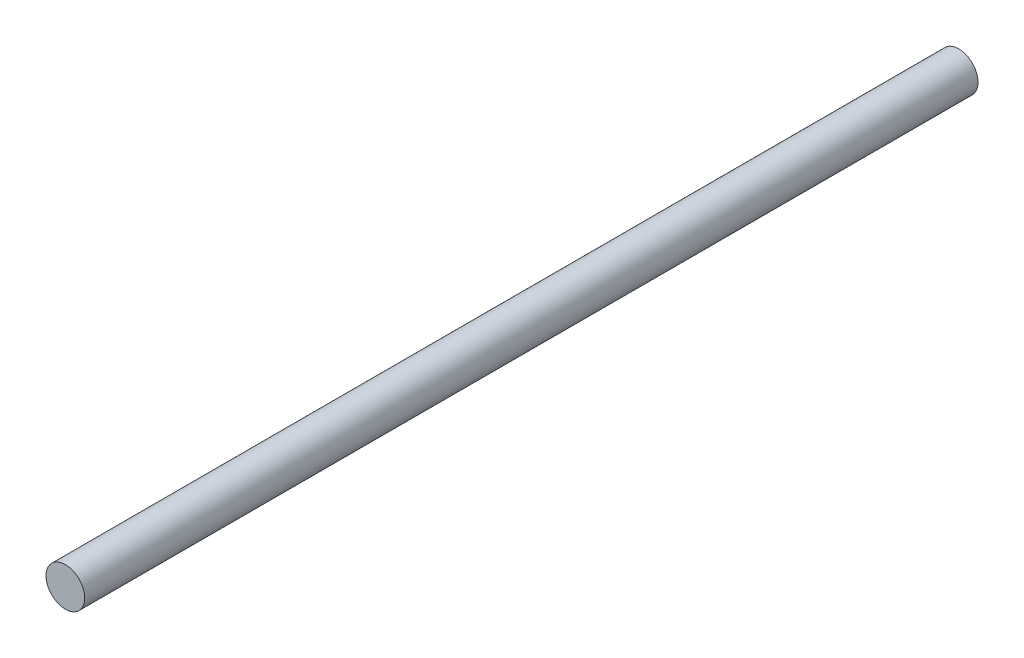
from build123d import *

# Parameters (mm, degrees)
SKETCH1_W = 3.9
SKETCH1_H = 180


with BuildPart() as part:
    # Sketch1 → Revolve1 (revolve)
    with BuildSketch(Plane.XZ, mode=Mode.PRIVATE) as revolve1_sk:
        with Locations((1.95, 90)):
            Rectangle(SKETCH1_W, SKETCH1_H)
    revolve(revolve1_sk.sketch.rotate(Axis((0, 0, 180), (0, 0, -1)), 180), axis=Axis((0, 0, 180), (0, 0, -1)))


solid = part.part
